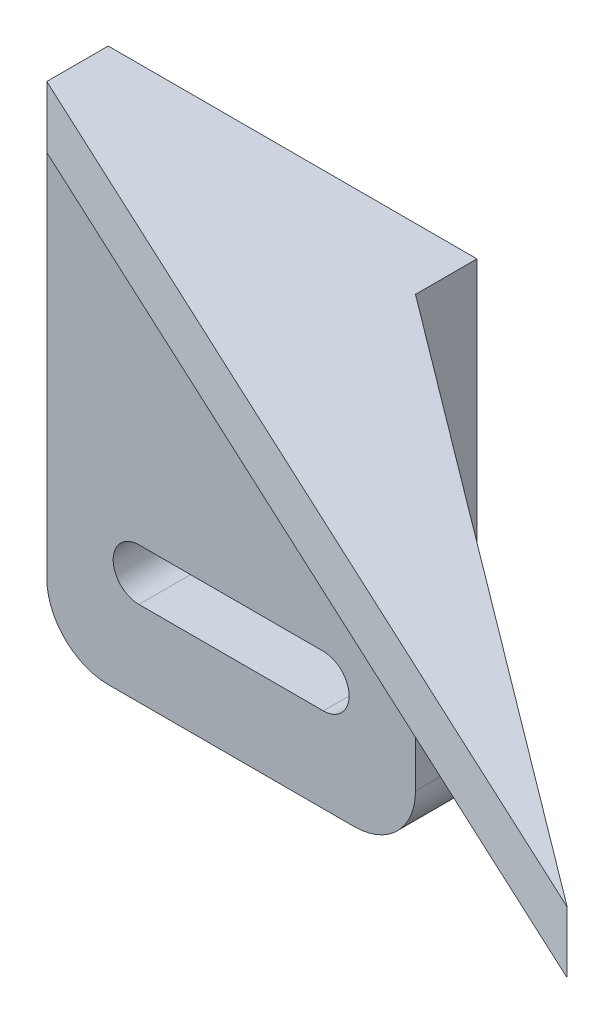
from build123d import *

# Parameters (mm, degrees)
SKETCH1_W           = 30
SKETCH1_H           = 40
BOSS_EXTRUDE1_DEPTH = 5
BOSS_EXTRUDE2_DEPTH = 5
FILLET1_R           = 5
CUT_EXTRUDE1_DEPTH  = 5


with BuildPart() as part:
    # Sketch1 → Boss-Extrude1 (new body)
    with BuildSketch(Plane.XY):
        Rectangle(SKETCH1_W, SKETCH1_H)
    extrude(amount=BOSS_EXTRUDE1_DEPTH)

    # Sketch2 → Boss-Extrude2 (add)
    with BuildSketch(Plane(origin=(0, 20, 0), x_dir=(1, 0, 0), z_dir=(0, 1, 0))):
        Polygon((-15, -5), (64.346756059, -42), (15, -5), align=None)
    extrude(amount=-BOSS_EXTRUDE2_DEPTH)

    # Fillet1
    fillet1_edges = [part.edges().sort_by_distance(p)[0] for p in [
        (15, -20, 2.5),
        (-15, -20, 2.5),
    ]]
    fillet(fillet1_edges, radius=FILLET1_R)

    # Sketch3 → Cut-Extrude1 (cut)
    with BuildSketch(Plane(origin=(0, 0, 0), x_dir=(-1, 0, 0), z_dir=(0, 0, -1))):
        with BuildLine():
            Line((7.5, -13.1), (-7.5, -13.1))
            ThreePointArc((-7.5, -13.1), (-9.6, -11), (-7.5, -8.9))
            Line((-7.5, -8.9), (7.5, -8.9))
            ThreePointArc((7.5, -8.9), (9.6, -11), (7.5, -13.1))
        make_face()
    extrude(amount=-CUT_EXTRUDE1_DEPTH, mode=Mode.SUBTRACT)


solid = part.part
